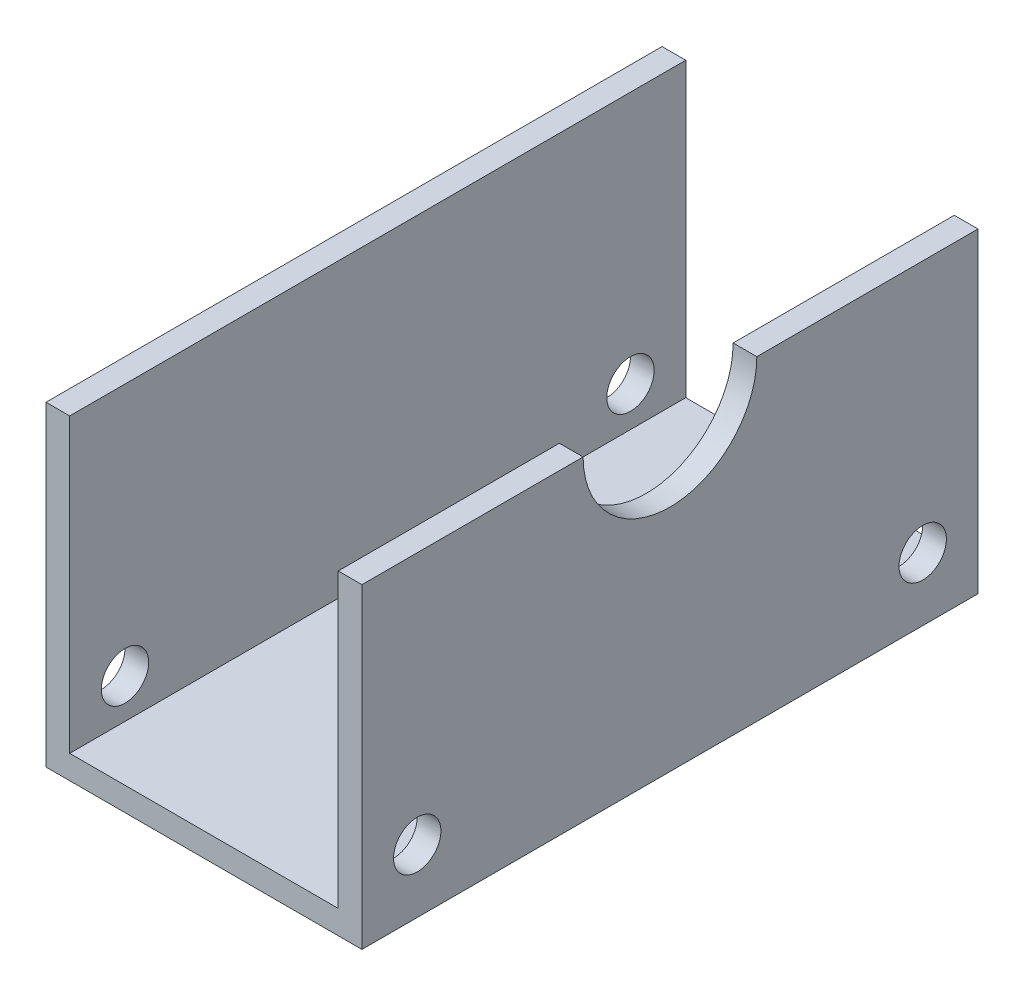
from build123d import *

# Parameters (mm, degrees)
EXTRUSION1_DEPTH = 39
ESQUISSE2_R      = 5.5
EXTRUSION2_DEPTH = 10
ESQUISSE3_R      = 1.5
EXTRUSION3_DEPTH = 47.864006287


with BuildPart() as part:
    # Esquisse1 → Extrusion1 (new body)
    with BuildSketch(Plane.XY):
        Polygon((-16.636265327, 16.590210526), (-16.636265327, -3.409789474), (3.363734673, -3.409789474), (3.363734673, 16.590210526), (1.863734673, 16.590210526), (1.863734673, -1.909789474), (-15.136265327, -1.909789474), (-15.136265327, 16.590210526), align=None)
    extrude(amount=EXTRUSION1_DEPTH)

    # Esquisse2 → Extrusion2 (cut)
    with BuildSketch(Plane(origin=(3.363734673, 0, 0), x_dir=(0, 0, -1), z_dir=(1, 0, 0))):
        with Locations((-19.5, 16.590210526)):
            Circle(ESQUISSE2_R)
    extrude(amount=-EXTRUSION2_DEPTH, mode=Mode.SUBTRACT)

    # Esquisse3 → Extrusion3 (cut, through all)
    with BuildSketch(Plane.ZY.offset(16.636265327)):
        with Locations(Location((3.5, 0.590210526, 0), (0, 0, 270))):
            Circle(ESQUISSE3_R)
        with Locations(Location((35.5, 0.590210526, 0), (0, 0, 270))):
            Circle(ESQUISSE3_R)
    extrude(amount=-EXTRUSION3_DEPTH, mode=Mode.SUBTRACT)


solid = part.part
